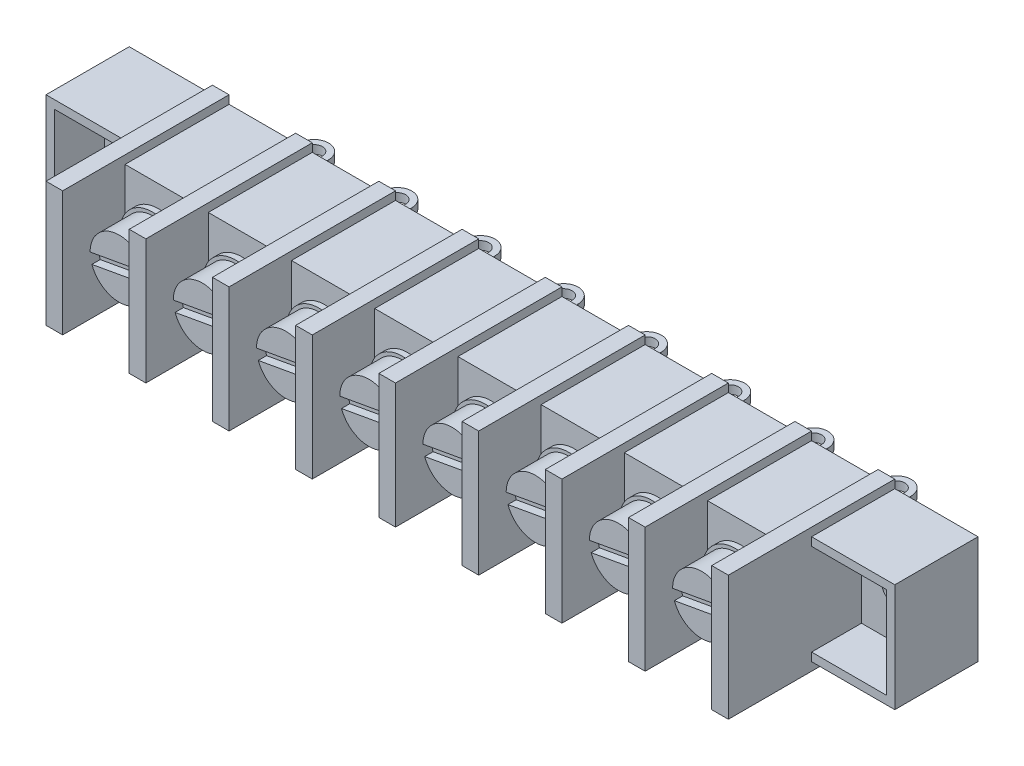
from build123d import *

# Parameters (mm, degrees)
SKETCH_1_W             = 82
SKETCH_1_H             = 15
EXTRUDE_1_DEPTH        = 10
SKETCH_2_W             = 2
SKETCH_2_H             = 15
EXTRUDE_2_DEPTH        = 10
SKETCH_3_W             = 8
SKETCH_3_H             = 15
EXTRUDE_3_DEPTH        = 2.5
SKETCH_4_R             = 3.9
EXTRUDE_4_DEPTH        = 0.7
SKETCH_6_R             = 3.5
EXTRUDE_5_DEPTH        = 4
CUT_EXTRUDE_START      = -1
CUT_EXTRUDE_1_DEPTH    = 1
SKETCH_8_W             = 3.5
SKETCH_8_H             = 1
EXTRUDE_6_DEPTH        = 8
SKETCH_10_W            = 10
SKETCH_10_H            = 15
EXTRUDE_7_DEPTH        = 10
SKETCH_11_W            = 10
SKETCH_11_H            = 15
EXTRUDE_8_DEPTH        = 10
SKETCH_12_R            = 1.6
CUT_EXTRUDE_2_DEPTH    = 10
SKETCH_13_W            = 9
SKETCH_13_H            = 11
CUT_EXTRUDE_3_DEPTH    = 6
SKETCH_14_W            = 8
SKETCH_14_H            = 1
SKETCH_14_W_2          = 10
CUT_EXTRUDE_4_DEPTH    = 20
CUT_EXTRUDE_5_DEPTH    = 20
PATTERN_LINEAR_1_COUNT = 8
PATTERN_LINEAR_1_PITCH = 10


with BuildPart() as part:
    # Эскиз1 → Вытянуть1 (new body)
    with BuildSketch(Plane.XY):
        Rectangle(SKETCH_1_W, SKETCH_1_H)
    extrude(amount=EXTRUDE_1_DEPTH)

    # Эскиз2 → Вытянуть2 (add)
    with BuildSketch(Plane.XY.offset(10)):
        with Locations((-40, 0)):
            Rectangle(SKETCH_2_W, SKETCH_2_H)
        with Locations((-30, 0)):
            Rectangle(SKETCH_2_W, SKETCH_2_H)
        Rectangle(SKETCH_2_W, SKETCH_2_H)
        with Locations((30, 0)):
            Rectangle(SKETCH_2_W, SKETCH_2_H)
        with Locations((40, 0)):
            Rectangle(SKETCH_2_W, SKETCH_2_H)
        with Locations((-20, 0)):
            Rectangle(SKETCH_2_W, SKETCH_2_H)
        with Locations((10, 0)):
            Rectangle(SKETCH_2_W, SKETCH_2_H)
        with Locations((-10, 0)):
            Rectangle(SKETCH_2_W, SKETCH_2_H)
        with Locations((20, 0)):
            Rectangle(SKETCH_2_W, SKETCH_2_H)
    extrude(amount=EXTRUDE_2_DEPTH)

    # Эскиз3 → Вытянуть3 (add)
    with BuildSketch(Plane.XY.offset(10)):
        with Locations((-35, 0)):
            Rectangle(SKETCH_3_W, SKETCH_3_H)
        with Locations((-25, 0)):
            Rectangle(SKETCH_3_W, SKETCH_3_H)
        with Locations((-15, 0)):
            Rectangle(SKETCH_3_W, SKETCH_3_H)
        with Locations((-5, 0)):
            Rectangle(SKETCH_3_W, SKETCH_3_H)
        with Locations((5, 0)):
            Rectangle(SKETCH_3_W, SKETCH_3_H)
        with Locations((15, 0)):
            Rectangle(SKETCH_3_W, SKETCH_3_H)
        with Locations((25, 0)):
            Rectangle(SKETCH_3_W, SKETCH_3_H)
        with Locations((35, 0)):
            Rectangle(SKETCH_3_W, SKETCH_3_H)
    extrude(amount=EXTRUDE_3_DEPTH)

    # Эскиз4 → Вытянуть4 (add)
    with BuildSketch(Plane.XY.offset(12.5)):
        with Locations(Location((-35, 0, 0), (0, 0, 180))):
            Circle(SKETCH_4_R)
        with Locations((-25, 0)):
            Circle(SKETCH_4_R)
        with Locations((-15, 0)):
            Circle(SKETCH_4_R)
        with Locations((-5, 0)):
            Circle(SKETCH_4_R)
        with Locations(Location((5, 0, 0), (0, 0, 180))):
            Circle(SKETCH_4_R)
        with Locations(Location((15, 0, 0), (0, 0, 180))):
            Circle(SKETCH_4_R)
        with Locations(Location((25, 0, 0), (0, 0, 180))):
            Circle(SKETCH_4_R)
        with Locations(Location((35, 0, 0), (0, 0, 180))):
            Circle(SKETCH_4_R)
    extrude(amount=EXTRUDE_4_DEPTH)

    # Эскиз6 → Вытянуть5 (add)
    with BuildSketch(Plane.XY.offset(13.2)):
        with Locations((-35, 0)):
            Circle(SKETCH_6_R)
        with Locations((-25, 0)):
            Circle(SKETCH_6_R)
        with Locations((-15, 0)):
            Circle(SKETCH_6_R)
        with Locations((-5, 0)):
            Circle(SKETCH_6_R)
        with Locations(Location((5, 0, 0), (0, 0, 180))):
            Circle(SKETCH_6_R)
        with Locations(Location((15, 0, 0), (0, 0, 180))):
            Circle(SKETCH_6_R)
        with Locations(Location((25, 0, 0), (0, 0, 180))):
            Circle(SKETCH_6_R)
        with Locations(Location((35, 0, 0), (0, 0, 180))):
            Circle(SKETCH_6_R)
    extrude(amount=EXTRUDE_5_DEPTH)

    # Эскиз7 → Вырез-Вытянуть1 (cut)
    with BuildSketch(Plane.XY.offset(17.2).offset(CUT_EXTRUDE_START)):
        with BuildLine():
            Line((-31.711388315, 1.197928706), (-38.49996022, -0.016687072))
            ThreePointArc((-38.49996022, -0.016687072), (-38.445288098, -0.616433226), (-38.288611685, -1.197928706))
            Line((-38.288611685, -1.197928706), (-31.50003978, 0.016687072))
            ThreePointArc((-31.50003978, 0.016687072), (-31.554711902, 0.616433226), (-31.711388315, 1.197928706))
        make_face()
        with BuildLine():
            Line((-21.711388315, 1.197928706), (-28.49996022, -0.016687072))
            ThreePointArc((-28.49996022, -0.016687072), (-28.445288098, -0.616433226), (-28.288611685, -1.197928706))
            Line((-28.288611685, -1.197928706), (-21.50003978, 0.016687072))
            ThreePointArc((-21.50003978, 0.016687072), (-21.554711902, 0.616433226), (-21.711388315, 1.197928706))
        make_face()
        with BuildLine():
            Line((-11.711388315, 1.197928706), (-18.49996022, -0.016687072))
            ThreePointArc((-18.49996022, -0.016687072), (-18.445288098, -0.616433226), (-18.288611685, -1.197928706))
            Line((-18.288611685, -1.197928706), (-11.50003978, 0.016687072))
            ThreePointArc((-11.50003978, 0.016687072), (-11.554711902, 0.616433226), (-11.711388315, 1.197928706))
        make_face()
        with BuildLine():
            Line((-1.711388315, 1.197928706), (-8.49996022, -0.016687072))
            ThreePointArc((-8.49996022, -0.016687072), (-8.445288098, -0.616433226), (-8.288611685, -1.197928706))
            Line((-8.288611685, -1.197928706), (-1.50003978, 0.016687072))
            ThreePointArc((-1.50003978, 0.016687072), (-1.554711902, 0.616433226), (-1.711388315, 1.197928706))
        make_face()
        with BuildLine():
            Line((8.288611685, 1.197928706), (1.50003978, -0.016687072))
            ThreePointArc((1.50003978, -0.016687072), (1.554711902, -0.616433226), (1.711388315, -1.197928706))
            Line((1.711388315, -1.197928706), (8.49996022, 0.016687072))
            ThreePointArc((8.49996022, 0.016687072), (8.445288098, 0.616433226), (8.288611685, 1.197928706))
        make_face()
        with BuildLine():
            Line((18.288611685, 1.197928706), (11.50003978, -0.016687072))
            ThreePointArc((11.50003978, -0.016687072), (11.554711902, -0.616433226), (11.711388315, -1.197928706))
            Line((11.711388315, -1.197928706), (18.49996022, 0.016687072))
            ThreePointArc((18.49996022, 0.016687072), (18.445288098, 0.616433226), (18.288611685, 1.197928706))
        make_face()
        with BuildLine():
            Line((28.288611685, 1.197928706), (21.50003978, -0.016687072))
            ThreePointArc((21.50003978, -0.016687072), (21.554711902, -0.616433226), (21.711388315, -1.197928706))
            Line((21.711388315, -1.197928706), (28.49996022, 0.016687072))
            ThreePointArc((28.49996022, 0.016687072), (28.445288098, 0.616433226), (28.288611685, 1.197928706))
        make_face()
        with BuildLine():
            Line((38.288611685, 1.197928706), (31.50003978, -0.016687072))
            ThreePointArc((31.50003978, -0.016687072), (31.554711902, -0.616433226), (31.711388315, -1.197928706))
            Line((31.711388315, -1.197928706), (38.49996022, 0.016687072))
            ThreePointArc((38.49996022, 0.016687072), (38.445288098, 0.616433226), (38.288611685, 1.197928706))
        make_face()
    extrude(amount=CUT_EXTRUDE_1_DEPTH, mode=Mode.SUBTRACT)

    # Эскиз8 → Вытянуть6 (add)
    with BuildSketch(Plane(origin=(0, 0, 0), x_dir=(-1, 0, 0), z_dir=(0, 0, -1))):
        with Locations((25, 0)):
            Rectangle(SKETCH_8_W, SKETCH_8_H)
        with Locations((15, 0)):
            Rectangle(SKETCH_8_W, SKETCH_8_H)
        with Locations((5, 0)):
            Rectangle(SKETCH_8_W, SKETCH_8_H)
        with Locations((-5, 0)):
            Rectangle(SKETCH_8_W, SKETCH_8_H)
        with Locations((-15, 0)):
            Rectangle(SKETCH_8_W, SKETCH_8_H)
        with Locations((-25, 0)):
            Rectangle(SKETCH_8_W, SKETCH_8_H)
        with Locations((-35, 0)):
            Rectangle(SKETCH_8_W, SKETCH_8_H)
        with Locations((35, 0)):
            Rectangle(SKETCH_8_W, SKETCH_8_H)
    extrude(amount=EXTRUDE_6_DEPTH)

    # Эскиз10 → Вытянуть7 (add)
    with BuildSketch(Plane.ZY.offset(41)):
        with Locations((5, 0)):
            Rectangle(SKETCH_10_W, SKETCH_10_H)
    extrude(amount=EXTRUDE_7_DEPTH)

    # Эскиз11 → Вытянуть8 (add)
    with BuildSketch(Plane(origin=(41, 0, 0), x_dir=(0, 0, -1), z_dir=(1, 0, 0))):
        with Locations((-5, 0)):
            Rectangle(SKETCH_11_W, SKETCH_11_H)
    extrude(amount=EXTRUDE_8_DEPTH)

    # Эскиз12 → Вырез-Вытянуть2 (cut)
    with BuildSketch(Plane.XY.offset(10)):
        with Locations((45, 0)):
            Circle(SKETCH_12_R)
        with Locations(Location((-45, 0, 0), (0, 0, 180))):
            Circle(SKETCH_12_R)
    extrude(amount=-CUT_EXTRUDE_2_DEPTH, mode=Mode.SUBTRACT)

    # Эскиз13 → Вырез-Вытянуть3 (cut)
    with BuildSketch(Plane.XY.offset(10)):
        with Locations((45.5, 0)):
            Rectangle(SKETCH_13_W, SKETCH_13_H)
        with Locations((-45.5, 0)):
            Rectangle(SKETCH_13_W, SKETCH_13_H)
    extrude(amount=-CUT_EXTRUDE_3_DEPTH, mode=Mode.SUBTRACT)

    # Эскиз14 → Вырез-Вытянуть4 (cut)
    with BuildSketch(Plane.XY.offset(12.5)):
        with Locations((35, 7)):
            Rectangle(SKETCH_14_W, SKETCH_14_H)
        with Locations((46, 7)):
            Rectangle(SKETCH_14_W_2, SKETCH_14_H)
        with Locations((46, -7)):
            Rectangle(SKETCH_14_W_2, SKETCH_14_H)
        with Locations((35, -7)):
            Rectangle(SKETCH_14_W, SKETCH_14_H)
        with Locations((25, 7)):
            Rectangle(SKETCH_14_W, SKETCH_14_H)
        with Locations((25, -7)):
            Rectangle(SKETCH_14_W, SKETCH_14_H)
        with Locations((15, 7)):
            Rectangle(SKETCH_14_W, SKETCH_14_H)
        with Locations((15, -7)):
            Rectangle(SKETCH_14_W, SKETCH_14_H)
        with Locations((5, 7)):
            Rectangle(SKETCH_14_W, SKETCH_14_H)
        with Locations((5, -7)):
            Rectangle(SKETCH_14_W, SKETCH_14_H)
        with Locations((-5, 7)):
            Rectangle(SKETCH_14_W, SKETCH_14_H)
        with Locations((-5, -7)):
            Rectangle(SKETCH_14_W, SKETCH_14_H)
        with Locations((-15, 7)):
            Rectangle(SKETCH_14_W, SKETCH_14_H)
        with Locations((-15, -7)):
            Rectangle(SKETCH_14_W, SKETCH_14_H)
        with Locations((-25, 7)):
            Rectangle(SKETCH_14_W, SKETCH_14_H)
        with Locations((-25, -7)):
            Rectangle(SKETCH_14_W, SKETCH_14_H)
        with Locations((-35, 7)):
            Rectangle(SKETCH_14_W, SKETCH_14_H)
        with Locations((-35, -7)):
            Rectangle(SKETCH_14_W, SKETCH_14_H)
        with Locations((-46, -7)):
            Rectangle(SKETCH_14_W_2, SKETCH_14_H)
        with Locations((-46, 7)):
            Rectangle(SKETCH_14_W_2, SKETCH_14_H)
    extrude(amount=-CUT_EXTRUDE_4_DEPTH, mode=Mode.SUBTRACT)

    # Эскиз15 → Вырез-Вытянуть5 (cut)
    with BuildSketch(Plane.XZ.offset(0.5)):
        with BuildLine():
            Line((33.25, -6.212418118), (33.25, -10.544797806))
            Line((33.25, -10.544797806), (36.75, -10.544797806))
            Line((36.75, -10.544797806), (36.75, -6.212418118))
            ThreePointArc((36.75, -6.212418118), (35, -7.962418118), (33.25, -6.212418118))
        make_face()
        with BuildLine():
            Line((34, -6.212418118), (34, -5.812418118))
            ThreePointArc((34, -5.812418118), (35, -4.812418118), (36, -5.812418118))
            Line((36, -5.812418118), (36, -6.212418118))
            ThreePointArc((36, -6.212418118), (35, -7.212418118), (34, -6.212418118))
        make_face()
    cut_extrude_5 = extrude(amount=-CUT_EXTRUDE_5_DEPTH, mode=Mode.SUBTRACT)

    # Линейный массив1: Вырез-Вытянуть5 ×8
    with Locations(*[(-i * PATTERN_LINEAR_1_PITCH, 0, 0) for i in range(1, PATTERN_LINEAR_1_COUNT)]):
        add(cut_extrude_5, mode=Mode.SUBTRACT)


solid = part.part
